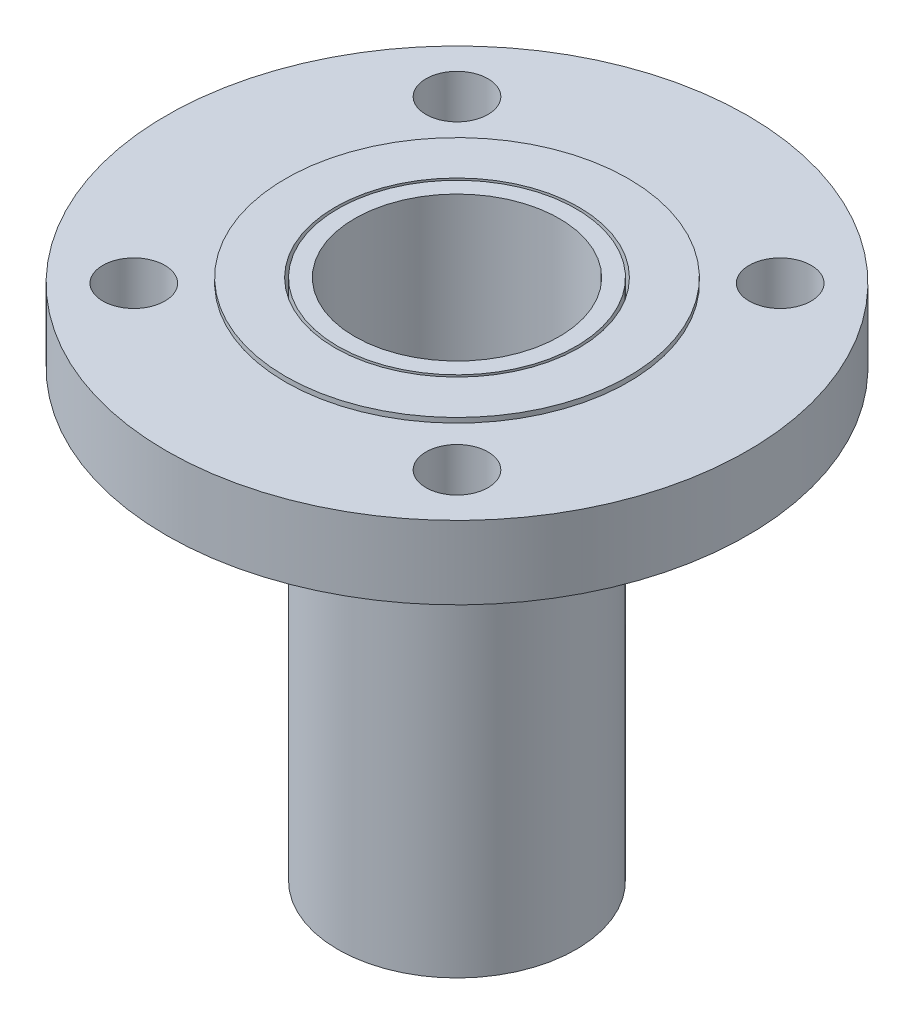
from build123d import *

# Parameters (mm, degrees)
SKETCH1_R           = 89
SKETCH1_R_2         = 37.35
SKETCH1_R_3         = 9.5
BOSS_EXTRUDE1_DEPTH = 22.4
SKETCH2_R           = 52.5
SKETCH2_R_2         = 37.35
BOSS_EXTRUDE2_DEPTH = 1.5
SKETCH3_R           = 36.5
SKETCH3_R_2         = 31.34
BOSS_EXTRUDE3_DEPTH = 160


with BuildPart() as part:
    # Sketch1 → Boss-Extrude1 (new body)
    with BuildSketch(Plane(origin=(0, 0, 0), x_dir=(1, 0, 0), z_dir=(0, 1, 0))):
        Circle(SKETCH1_R)
        Circle(SKETCH1_R_2, mode=Mode.SUBTRACT)
        with Locations((-49.497474683, 49.497474683)):
            Circle(SKETCH1_R_3, mode=Mode.SUBTRACT)
        with Locations((-49.497474683, -49.497474683)):
            Circle(SKETCH1_R_3, mode=Mode.SUBTRACT)
        with Locations((49.497474683, -49.497474683)):
            Circle(SKETCH1_R_3, mode=Mode.SUBTRACT)
        with Locations((49.497474683, 49.497474683)):
            Circle(SKETCH1_R_3, mode=Mode.SUBTRACT)
    extrude(amount=BOSS_EXTRUDE1_DEPTH)

    # Sketch2 → Boss-Extrude2 (add)
    with BuildSketch(Plane(origin=(0, 22.4, 0), x_dir=(1, 0, 0), z_dir=(0, 1, 0))):
        Circle(SKETCH2_R)
        Circle(SKETCH2_R_2, mode=Mode.SUBTRACT)
    extrude(amount=BOSS_EXTRUDE2_DEPTH)


with BuildPart() as body_2:
    # Sketch3 → Boss-Extrude3 (new body)
    with BuildSketch(Plane(origin=(0, 23.9, 0), x_dir=(1, 0, 0), z_dir=(0, 1, 0))):
        Circle(SKETCH3_R)
        Circle(SKETCH3_R_2, mode=Mode.SUBTRACT)
    extrude(amount=-BOSS_EXTRUDE3_DEPTH)


solid = Compound([part.part, body_2.part])
